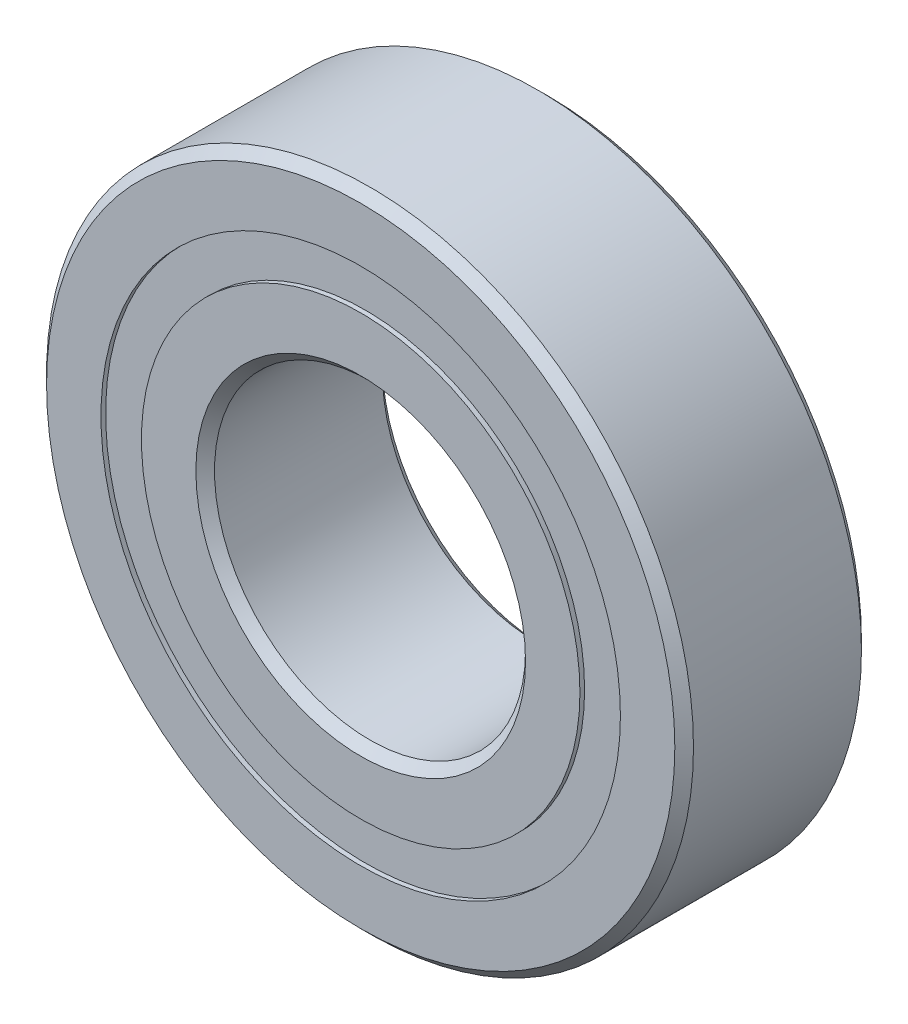
from build123d import *

# Parameters (mm, degrees)
CIRPATTERN1_COUNT = 12
SKETCH5_W         = 3.416064535
SKETCH5_H         = 3.252747252


with BuildPart() as part:
    # Sketch1 → Revolve1 (revolve)
    with BuildSketch(Plane(origin=(0, 0, 0), x_dir=(0, 0, -1), z_dir=(1, 0, 0))):
        with BuildLine():
            Line((6.75, 26), (-6.75, 26))
            Line((-6.75, 26), (-7.5, 25.25))
            Line((-7.5, 25.25), (-7.5, 20.876373626))
            Line((-7.5, 20.876373626), (-3.333333333, 20.876373626))
            ThreePointArc((-3.333333333, 20.876373626), (0, 22.958935465), (3.333333333, 20.876373626))
            Line((3.333333333, 20.876373626), (7.5, 20.876373626))
            Line((7.5, 20.876373626), (7.5, 25.25))
            Line((7.5, 25.25), (6.75, 26))
        make_face()
    revolve(axis=Axis((0, 0, 7.5), (0, 0, -1)))


with BuildPart() as body_2:
    # Sketch3 → Revolve3 (revolve)
    with BuildSketch(Plane(origin=(0, 0, 0), x_dir=(0, 0, -1), z_dir=(1, 0, 0))):
        with BuildLine():
            Line((-7.5, 17.623626374), (-3.333333333, 17.623626374))
            ThreePointArc((-3.333333333, 17.623626374), (0, 15.541064535), (3.333333333, 17.623626374))
            Line((3.333333333, 17.623626374), (7.5, 17.623626374))
            Line((7.5, 17.623626374), (7.5, 13.25))
            Line((7.5, 13.25), (6.75, 12.5))
            Line((6.75, 12.5), (-6.75, 12.5))
            Line((-6.75, 12.5), (-7.5, 13.25))
            Line((-7.5, 13.25), (-7.5, 17.623626374))
        make_face()
    revolve(axis=Axis((0, 0, 7.5), (0, 0, -1)))


with BuildPart() as body_3:
    # Sketch4 → Revolve4 (revolve)
    with BuildSketch(Plane(origin=(0, 0, 0), x_dir=(0, 0, -1), z_dir=(1, 0, 0))):
        with BuildLine():
            Line((-3.708935465, 19.25), (3.708935465, 19.25))
            ThreePointArc((3.708935465, 19.25), (0, 22.958935465), (-3.708935465, 19.25))
        make_face()
    revolve(axis=Axis((0, 19.25, 3.708935465), (0, 0, -1)))


with BuildPart() as cirpattern1_1:
    # CirPattern1: pattern copy
    add(body_3.part.rotate(Axis((0, 0, -7.5), (0, 0, 1)), 1 * 360 / CIRPATTERN1_COUNT))


with BuildPart() as cirpattern1_2:
    # CirPattern1: pattern copy
    add(body_3.part.rotate(Axis((0, 0, -7.5), (0, 0, 1)), 2 * 360 / CIRPATTERN1_COUNT))


with BuildPart() as cirpattern1_3:
    # CirPattern1: pattern copy
    add(body_3.part.rotate(Axis((0, 0, -7.5), (0, 0, 1)), 3 * 360 / CIRPATTERN1_COUNT))


with BuildPart() as cirpattern1_4:
    # CirPattern1: pattern copy
    add(body_3.part.rotate(Axis((0, 0, -7.5), (0, 0, 1)), 4 * 360 / CIRPATTERN1_COUNT))


with BuildPart() as cirpattern1_5:
    # CirPattern1: pattern copy
    add(body_3.part.rotate(Axis((0, 0, -7.5), (0, 0, 1)), 5 * 360 / CIRPATTERN1_COUNT))


with BuildPart() as cirpattern1_6:
    # CirPattern1: pattern copy
    add(body_3.part.rotate(Axis((0, 0, -7.5), (0, 0, 1)), 6 * 360 / CIRPATTERN1_COUNT))


with BuildPart() as cirpattern1_7:
    # CirPattern1: pattern copy
    add(body_3.part.rotate(Axis((0, 0, -7.5), (0, 0, 1)), 7 * 360 / CIRPATTERN1_COUNT))


with BuildPart() as cirpattern1_8:
    # CirPattern1: pattern copy
    add(body_3.part.rotate(Axis((0, 0, -7.5), (0, 0, 1)), 8 * 360 / CIRPATTERN1_COUNT))


with BuildPart() as cirpattern1_9:
    # CirPattern1: pattern copy
    add(body_3.part.rotate(Axis((0, 0, -7.5), (0, 0, 1)), 9 * 360 / CIRPATTERN1_COUNT))


with BuildPart() as cirpattern1_10:
    # CirPattern1: pattern copy
    add(body_3.part.rotate(Axis((0, 0, -7.5), (0, 0, 1)), 10 * 360 / CIRPATTERN1_COUNT))


with BuildPart() as cirpattern1_11:
    # CirPattern1: pattern copy
    add(body_3.part.rotate(Axis((0, 0, -7.5), (0, 0, 1)), 11 * 360 / CIRPATTERN1_COUNT))


with BuildPart() as body_15:
    # Sketch5 → Revolve5 (revolve)
    with BuildSketch(Plane(origin=(0, 0, 0), x_dir=(0, 0, -1), z_dir=(1, 0, 0))):
        with Locations((-5.416967732, 19.25)):
            Rectangle(SKETCH5_W, SKETCH5_H)
        with Locations((5.416967732, 19.25)):
            Rectangle(SKETCH5_W, SKETCH5_H)
    revolve(axis=Axis((0, 0, 7.5), (0, 0, -1)))


solid = Compound([part.part, body_2.part, body_3.part, cirpattern1_1.part, cirpattern1_2.part, cirpattern1_3.part, cirpattern1_4.part, cirpattern1_5.part, cirpattern1_6.part, cirpattern1_7.part, cirpattern1_8.part, cirpattern1_9.part, cirpattern1_10.part, cirpattern1_11.part, body_15.part])
